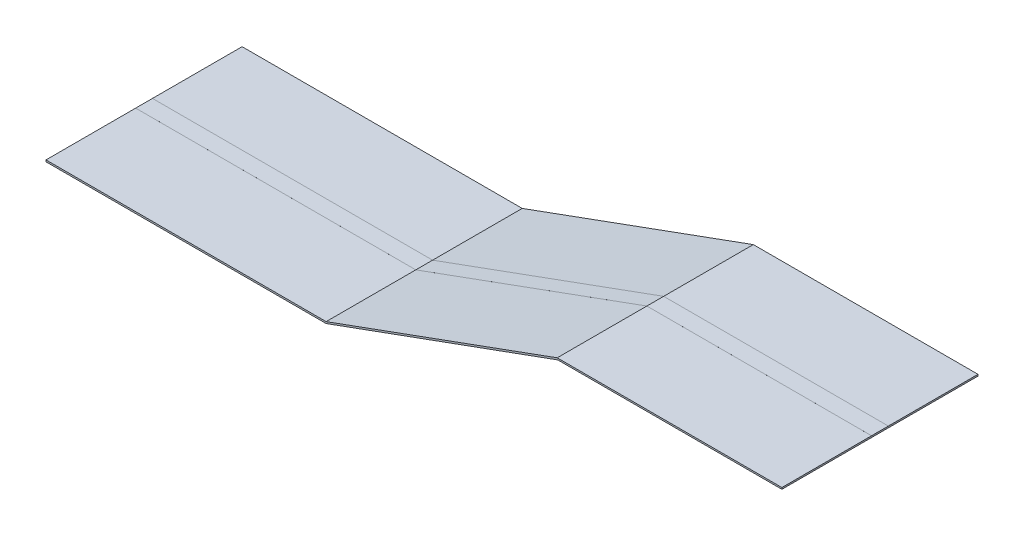
from build123d import *

# Parameters (mm, degrees)
BOSS_EXTRUDE3_DEPTH = 350
SKETCH5_W           = 500
SKETCH5_H           = 30
BOSS_EXTRUDE4_DEPTH = 0.01
SKETCH6_W           = 438.972740408
SKETCH6_H           = 30
BOSS_EXTRUDE5_DEPTH = 0.01
SKETCH7_W           = 401.023798147
SKETCH7_H           = 30
BOSS_EXTRUDE6_DEPTH = 0.01


with BuildPart() as part:
    # Sketch2 → Boss-Extrude3 (new body)
    with BuildSketch(Plane.XY):
        Polygon((0, 0), (-500, 0), (-500, 3), (0, 3), (412.437530925, 153.307517797), (813.464753146, 153.307517797), (813.464753146, 150.488863063), (413.464753146, 150.488863063), align=None)
    extrude(amount=BOSS_EXTRUDE3_DEPTH)

    # Sketch5 → Boss-Extrude4 (add)
    with BuildSketch(Plane(origin=(0, 3, 0), x_dir=(1, 0, 0), z_dir=(0, 1, 0))):
        with Locations((-250, -175)):
            Rectangle(SKETCH5_W, SKETCH5_H)
    extrude(amount=BOSS_EXTRUDE4_DEPTH)

    # Sketch6 → Boss-Extrude5 (add)
    with BuildSketch(Plane(origin=(-0.965128259, 2.648271503, 0), x_dir=(0.9395515779432226, 0.34240740702327194, 0), z_dir=(-0.34240740702327194, 0.9395515779432226, 0))):
        with Locations((220.513592425, -175)):
            Rectangle(SKETCH6_W, SKETCH6_H)
    extrude(amount=BOSS_EXTRUDE5_DEPTH)

    # Sketch7 → Boss-Extrude6 (add)
    with BuildSketch(Plane(origin=(0, 153.307517797, 0), x_dir=(1, 0, 0), z_dir=(0, 1, 0))):
        with Locations((612.949429999, -175)):
            Rectangle(SKETCH7_W, SKETCH7_H)
    extrude(amount=BOSS_EXTRUDE6_DEPTH)


solid = part.part
